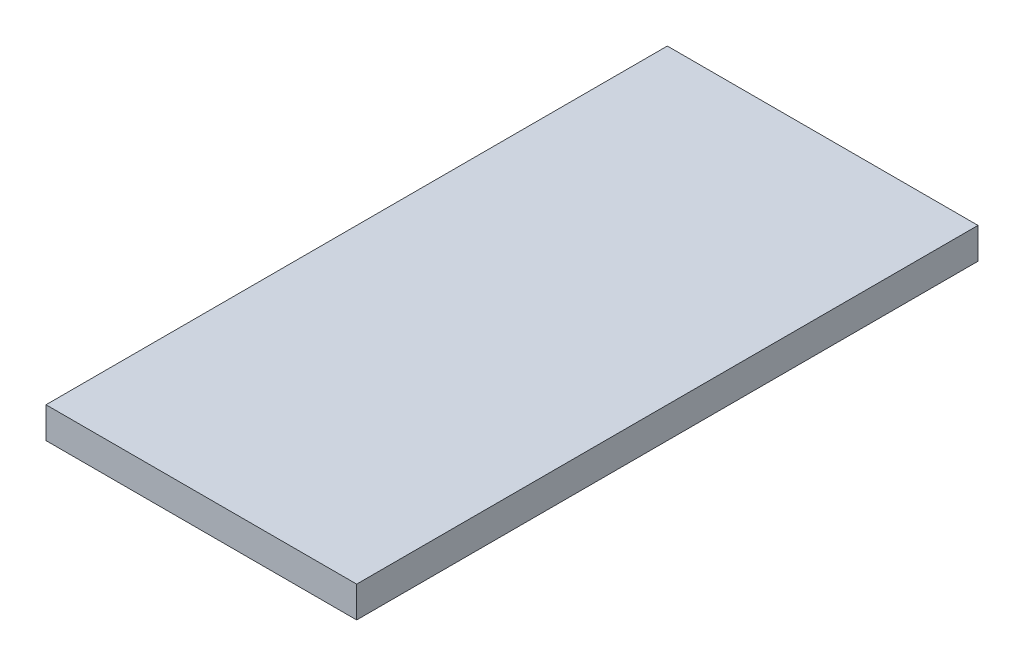
from build123d import *

# Parameters (mm, degrees)
SZKIC1_W                    = 50
SZKIC1_H                    = 100
DODANIE_WYCI_GNI_CIE1_DEPTH = 5


with BuildPart() as part:
    # Szkic1 → Dodanie-wyciągnięcie1 (new body)
    with BuildSketch(Plane(origin=(0, 0, 0), x_dir=(1, 0, 0), z_dir=(0, 1, 0))):
        with Locations((25, 50)):
            Rectangle(SZKIC1_W, SZKIC1_H)
    extrude(amount=DODANIE_WYCI_GNI_CIE1_DEPTH)


solid = part.part
